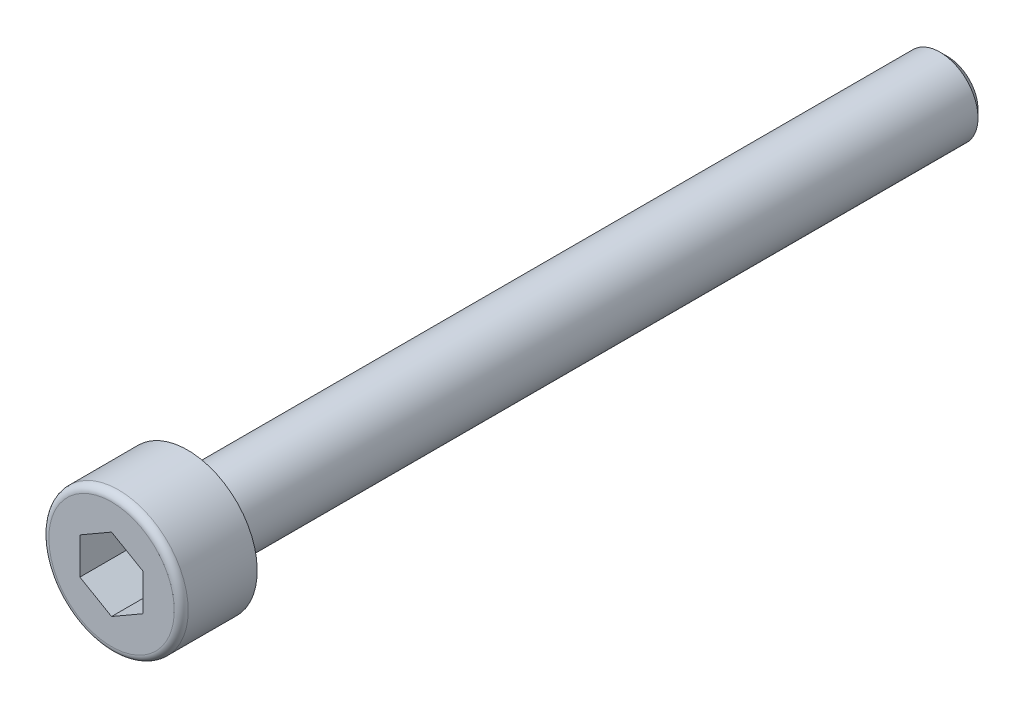
from build123d import *

# Parameters (mm, degrees)
CUT_EXTRUDE_1_DEPTH = 1.925
FILLET_1_R          = 0.275
CHAMFER_1_SIZE      = 0.3


with BuildPart() as part:
    # 草图3 → 旋转1 (revolve)
    with BuildSketch(Plane(origin=(0, 0, 0), x_dir=(0, 0, -1), z_dir=(1, 0, 0)), mode=Mode.PRIVATE) as revolve_1_sk:
        Polygon((-3, 0), (-3, 2.75), (0, 2.75), (0, 1.5), (30, 1.5), (30, 0), align=None)
    revolve(revolve_1_sk.sketch.rotate(Axis((0, 0, 3), (0, 0, -1)), 180), axis=Axis((0, 0, 3), (0, 0, -1)))

    # 草图4 → 切除-拉伸1 (cut)
    with BuildSketch(Plane.XY.offset(3)):
        Polygon((0, 1.443375673), (-1.25, 0.721687836), (-1.25, -0.721687836), (0, -1.443375673), (1.25, -0.721687836), (1.25, 0.721687836), align=None)
    extrude(amount=-CUT_EXTRUDE_1_DEPTH, mode=Mode.SUBTRACT)

    # 圆角1
    fillet_1_edges = [part.edges().sort_by_distance(p)[0] for p in [
        (0, 2.75, 3),
    ]]
    fillet(fillet_1_edges, radius=FILLET_1_R)

    # 倒角1
    chamfer_1_edges = [part.edges().sort_by_distance(p)[0] for p in [
        (0, 1.5, -30),
    ]]
    chamfer(chamfer_1_edges, length=CHAMFER_1_SIZE)


solid = part.part
